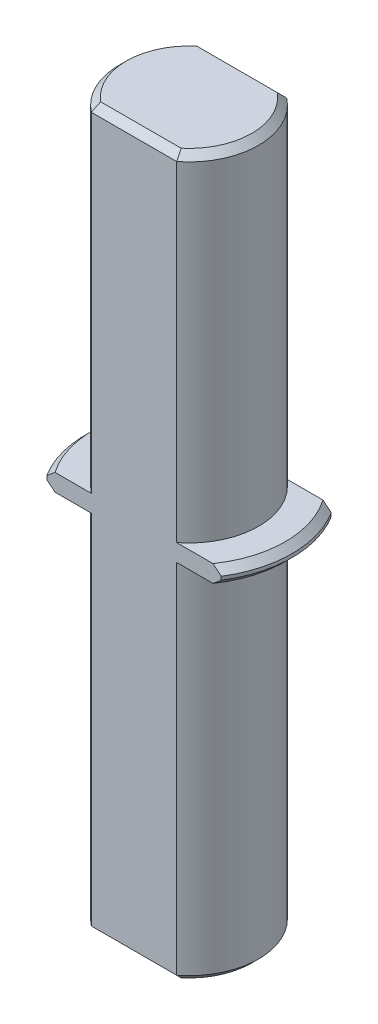
from build123d import *

# Parameters (mm, degrees)
BOSS_EXTRUDE1_DEPTH = 41.8
CHAMFER1_SIZE       = 0.4
BOSS_EXTRUDE2_DEPTH = 1
CHAMFER2_SIZE       = 0.4


with BuildPart() as part:
    # Sketch1 → Boss-Extrude1 (new body)
    with BuildSketch(Plane(origin=(0, 0, 0), x_dir=(1, 0, 0), z_dir=(0, 1, 0))):
        with BuildLine():
            ThreePointArc((-2.482438317, 3.2), (-4.05, 0), (-2.482438317, -3.2))
            Line((-2.482438317, -3.2), (2.482438317, -3.2))
            ThreePointArc((2.482438317, -3.2), (4.05, 0), (2.482438317, 3.2))
            Line((2.482438317, 3.2), (-2.482438317, 3.2))
        make_face()
    extrude(amount=BOSS_EXTRUDE1_DEPTH)

    # Chamfer1
    chamfer1_edges = [part.edges().sort_by_distance(p)[0] for p in [
        (0, 0, 3.2),
        (0, 41.8, 3.2),
        (0, 0, -3.2),
        (-4.05, 0, 0),
        (-4.05, 41.8, 0),
        (0, 41.8, -3.2),
        (4.05, 0, 0),
        (4.05, 41.8, 0),
    ]]
    chamfer(chamfer1_edges, length=CHAMFER1_SIZE)

    # Sketch2 → Boss-Extrude2 (add)
    with BuildSketch(Plane(origin=(0, 22.2, 0), x_dir=(1, 0, 0), z_dir=(0, 1, 0))):
        with BuildLine():
            Line((-5.075431016, -3.2), (5.075431016, -3.2))
            ThreePointArc((5.075431016, -3.2), (6, 0), (5.075431016, 3.2))
            Line((5.075431016, 3.2), (-5.075431016, 3.2))
            ThreePointArc((-5.075431016, 3.2), (-6, 0), (-5.075431016, -3.2))
        make_face()
    extrude(amount=-BOSS_EXTRUDE2_DEPTH)

    # Chamfer2
    chamfer2_edges = [part.edges().sort_by_distance(p)[0] for p in [
        (6, 21.2, 0),
        (6, 22.2, 0),
        (-6, 21.2, 0),
        (-6, 22.2, 0),
    ]]
    chamfer(chamfer2_edges, length=CHAMFER2_SIZE)


solid = part.part
